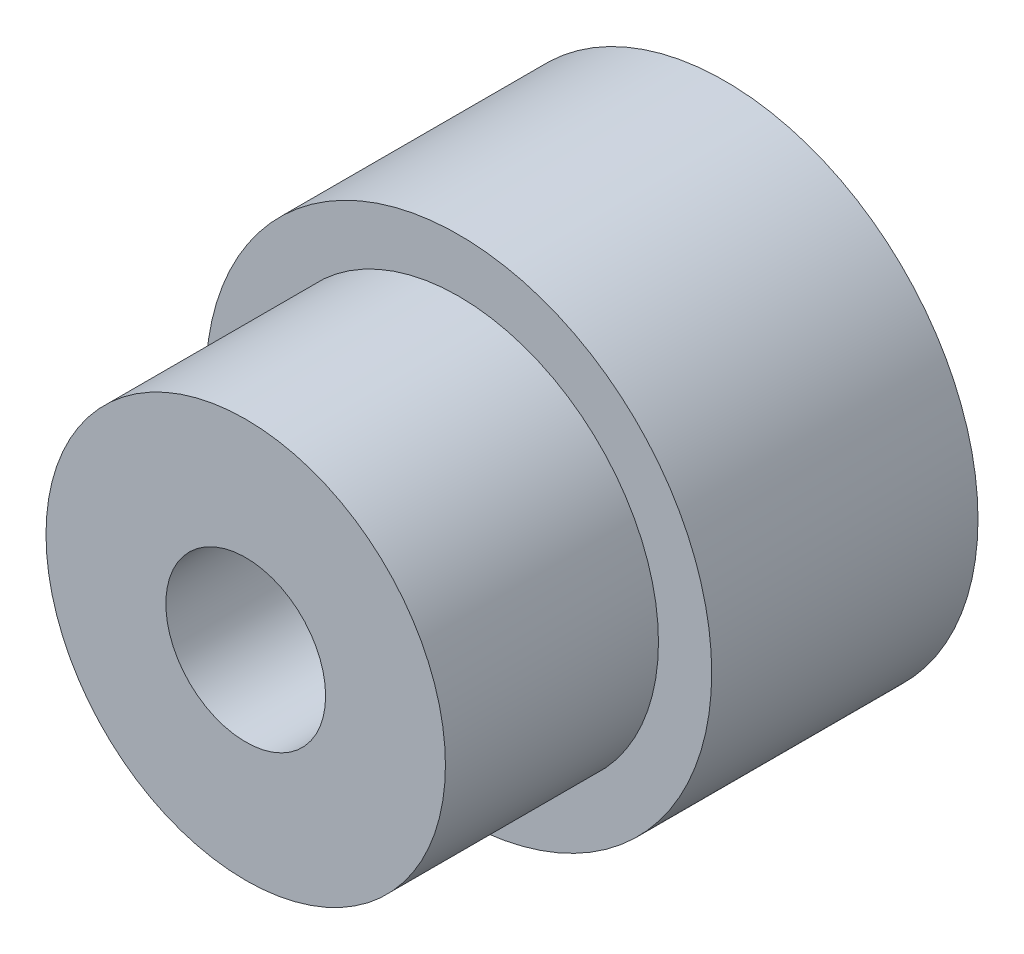
from build123d import *

# Parameters (mm, degrees)
SKETCH_1_R      = 9.5
SKETCH_1_R_2    = 3
EXTRUDE_1_DEPTH = 10
SKETCH_2_R      = 7.5
SKETCH_2_R_2    = 3
EXTRUDE_2_DEPTH = 8


with BuildPart() as part:
    # 草图1 → 凸台-拉伸1 (new body)
    with BuildSketch(Plane.XY):
        Circle(SKETCH_1_R)
        Circle(SKETCH_1_R_2, mode=Mode.SUBTRACT)
    extrude(amount=EXTRUDE_1_DEPTH)

    # 草图2 → 凸台-拉伸2 (add)
    with BuildSketch(Plane.XY.offset(10)):
        Circle(SKETCH_2_R)
        Circle(SKETCH_2_R_2, mode=Mode.SUBTRACT)
    extrude(amount=EXTRUDE_2_DEPTH)


solid = part.part
